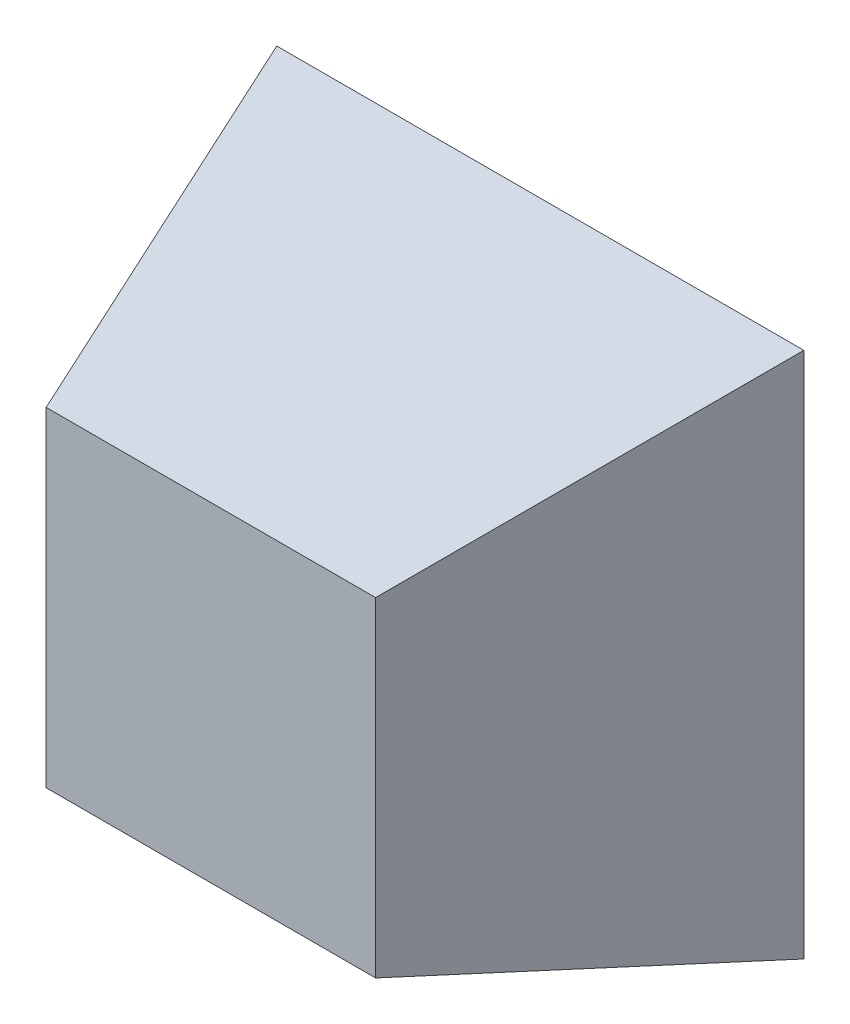
from build123d import *

# Parameters (mm, degrees)
ESBO_O1_W                = 80
ESBO_O1_H                = 80
RESSALTO_EXTRUS_O1_DEPTH = 50
CORTE_EXTRUS_O3_DEPTH    = 103.46950766
CORTE_EXTRUS_O4_DEPTH    = 103.46950766


with BuildPart() as part:
    # Esboço1 → Ressalto-extrusão1 (new body)
    with BuildSketch(Plane.XY):
        Rectangle(ESBO_O1_W, ESBO_O1_H)
    extrude(amount=RESSALTO_EXTRUS_O1_DEPTH)

    # Esboço3 → Corte-extrusão3 (cut, through all)
    with BuildSketch(Plane.ZY.offset(40)):
        Polygon((50, 25), (0, 40), (50, 40), align=None)
        Polygon((50, -25), (0, -40), (50, -40), align=None)
    extrude(amount=-CORTE_EXTRUS_O3_DEPTH, mode=Mode.SUBTRACT)

    # Esboço8 → Corte-extrusão4 (cut, through all)
    with BuildSketch(Plane(origin=(0, -40, 0), x_dir=(-1, 0, 0), z_dir=(0, -1, 0))):
        Polygon((25, -50), (40, 0), (40, -50), align=None)
        Polygon((-25, -50), (-40, -50), (-40, 0), align=None)
    extrude(amount=-CORTE_EXTRUS_O4_DEPTH, mode=Mode.SUBTRACT)


solid = part.part
